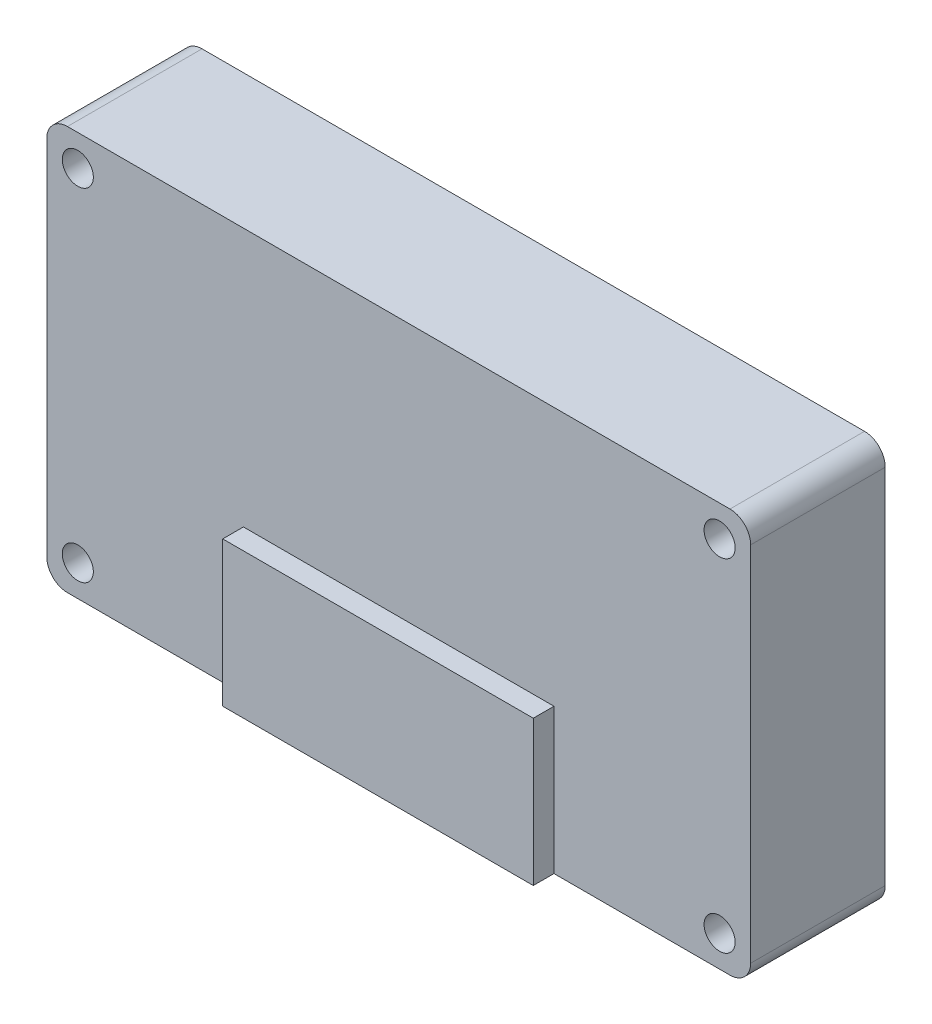
from build123d import *

# Parameters (mm, degrees)
CROQUIS1_W              = 68
CROQUIS1_H              = 39
CROQUIS1_R              = 1.5
SALIENTE_EXTRUIR1_DEPTH = 13
REDONDEO1_R             = 2
CROQUIS2_W              = 30
CROQUIS2_H              = 14
SALIENTE_EXTRUIR2_DEPTH = 2


with BuildPart() as part:
    # Croquis1 → Saliente-Extruir1 (new body)
    with BuildSketch(Plane.XY):
        with Locations((34, 19.5)):
            Rectangle(CROQUIS1_W, CROQUIS1_H)
        with Locations(Location((3, 36, 0), (0, 0, 180))):
            Circle(CROQUIS1_R, mode=Mode.SUBTRACT)
        with Locations(Location((3, 3, 0), (0, 0, 180))):
            Circle(CROQUIS1_R, mode=Mode.SUBTRACT)
        with Locations(Location((65, 36, 0), (0, 0, 180))):
            Circle(CROQUIS1_R, mode=Mode.SUBTRACT)
        with Locations(Location((65, 3, 0), (0, 0, 180))):
            Circle(CROQUIS1_R, mode=Mode.SUBTRACT)
    extrude(amount=SALIENTE_EXTRUIR1_DEPTH)

    # Redondeo1
    redondeo1_edges = [part.edges().sort_by_distance(p)[0] for p in [
        (0, 39, 6.5),
        (68, 39, 6.5),
        (68, 0, 6.5),
        (0, 0, 6.5),
    ]]
    fillet(redondeo1_edges, radius=REDONDEO1_R)

    # Croquis2 → Saliente-Extruir2 (add)
    with BuildSketch(Plane.XY.offset(13)):
        with Locations((34, 7)):
            Rectangle(CROQUIS2_W, CROQUIS2_H)
    extrude(amount=SALIENTE_EXTRUIR2_DEPTH)


solid = part.part
